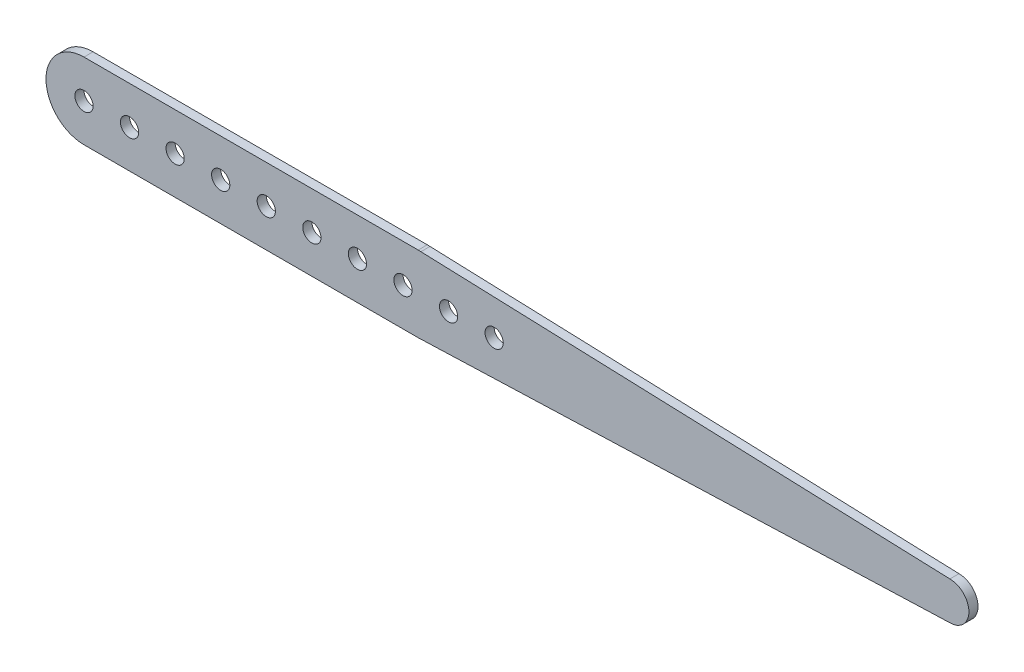
from build123d import *

# Parameters (mm, degrees)
SKETCH1_R           = 3
BOSS_EXTRUDE1_DEPTH = 3
SKETCH2_R           = 3
CUT_EXTRUDE1_DEPTH  = 3


with BuildPart() as part:
    # Sketch1 → Boss-Extrude1 (new body)
    with BuildSketch(Plane.XY):
        with BuildLine():
            Line((175.891719745, 12.468152866), (350, 6.25))
            ThreePointArc((350, 6.25), (356.25, 0), (350, -6.25))
            Line((350, -6.25), (175.891719745, -12.468152866))
            ThreePointArc((175.891719745, -12.468152866), (175.446144131, -12.492035679), (175, -12.5))
            Line((175, -12.5), (65, -12.5))
            ThreePointArc((65, -12.5), (52.5, 0), (65, 12.5))
            Line((65, 12.5), (175, 12.5))
            ThreePointArc((175, 12.5), (175.446144131, 12.492035679), (175.891719745, 12.468152866))
        make_face()
        with Locations((65, 0)):
            Circle(SKETCH1_R, mode=Mode.SUBTRACT)
        with Locations((80, 0)):
            Circle(SKETCH1_R, mode=Mode.SUBTRACT)
        with Locations((95, 0)):
            Circle(SKETCH1_R, mode=Mode.SUBTRACT)
        with Locations((110, 0)):
            Circle(SKETCH1_R, mode=Mode.SUBTRACT)
        with Locations((125, 0)):
            Circle(SKETCH1_R, mode=Mode.SUBTRACT)
        with Locations((140, 0)):
            Circle(SKETCH1_R, mode=Mode.SUBTRACT)
        with Locations((155, 0)):
            Circle(SKETCH1_R, mode=Mode.SUBTRACT)
        with Locations((170, 0)):
            Circle(SKETCH1_R, mode=Mode.SUBTRACT)
        with Locations((185, 0)):
            Circle(SKETCH1_R, mode=Mode.SUBTRACT)
    extrude(amount=BOSS_EXTRUDE1_DEPTH)

    # Sketch2 → Cut-Extrude1 (cut)
    with BuildSketch(Plane.XY.offset(3)):
        with Locations((200, 0)):
            Circle(SKETCH2_R)
    extrude(amount=-CUT_EXTRUDE1_DEPTH, mode=Mode.SUBTRACT)


solid = part.part
